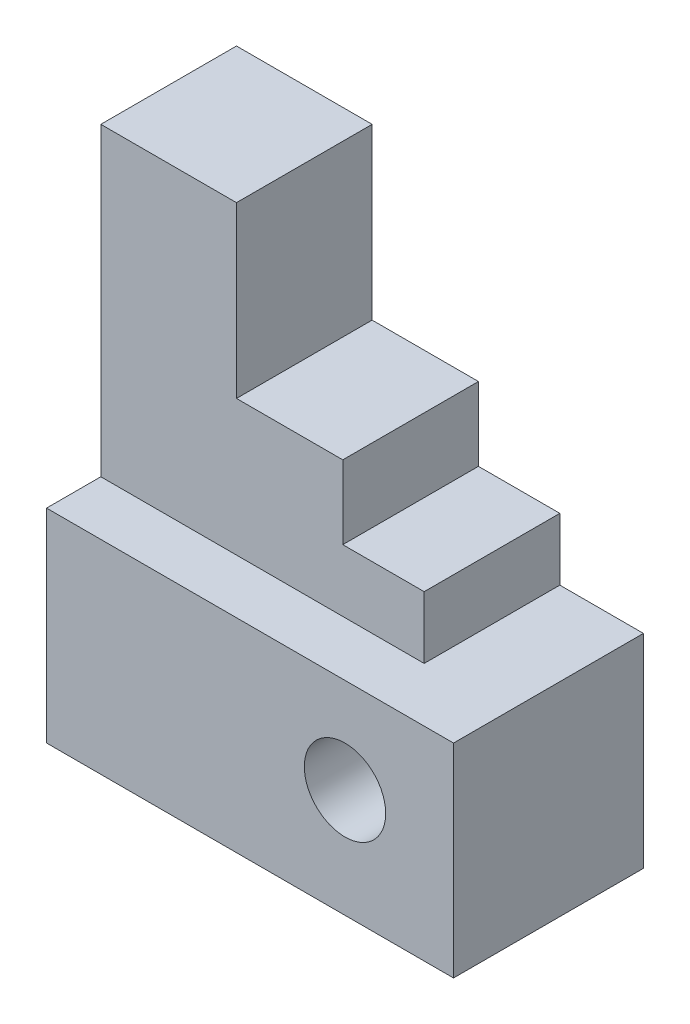
from build123d import *

# Parameters (mm, degrees)
SKETCH2_R           = 6
BOSS_EXTRUDE1_DEPTH = 28
BOSS_EXTRUDE2_DEPTH = 20


with BuildPart() as part:
    # Sketch2 → Boss-Extrude1 (new body)
    with BuildSketch(Plane.XY):
        Polygon((60, 30), (47.673729326, 30), (0, 30), (0, 0), (60, 0), align=None)
        with Locations((44, 16)):
            Circle(SKETCH2_R, mode=Mode.SUBTRACT)
    extrude(amount=BOSS_EXTRUDE1_DEPTH)

    # Sketch2<3> → Boss-Extrude2 (add)
    with BuildSketch(Plane.XY):
        Polygon((35.673729326, 39.1665834), (35.673729326, 50), (20, 50), (20, 75), (0, 75), (0, 50), (0, 30), (47.673729326, 30), (47.673729326, 39.1665834), align=None)
    extrude(amount=BOSS_EXTRUDE2_DEPTH)


solid = part.part
